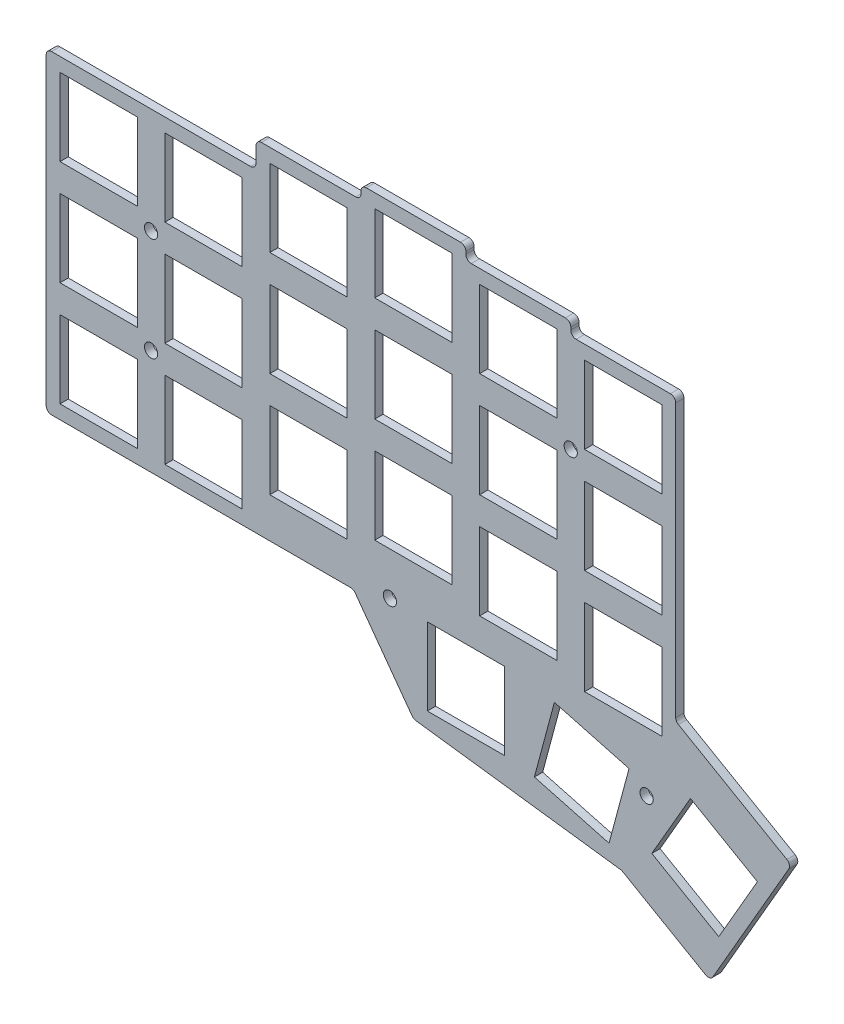
from build123d import *

# Parameters (mm, degrees)
SKETCH2_W           = 13.999999997
SKETCH2_H           = 13.999999996
SKETCH2_W_2         = 13.999999996
SKETCH2_R           = 1.2
SKETCH2_H_2         = 13.999999997
BOSS_EXTRUDE1_DEPTH = 1.5


with BuildPart() as part:
    # Sketch2 → Boss-Extrude1 (new body)
    with BuildSketch(Plane.XY):
        with BuildLine():
            ThreePointArc((3.358715952, 91.42556159), (2.678391323, 91.143761902), (2.396591635, 90.463437274))
            Line((2.396591635, 90.463437274), (2.396591635, 35.387693174))
            ThreePointArc((2.396591635, 35.387693174), (2.678391323, 34.707368546), (3.358715952, 34.425568858))
            Line((3.358715952, 34.425568858), (57.55538108, 34.425568858))
            ThreePointArc((57.55538108, 34.425568858), (57.991412266, 34.32109249), (58.332746845, 34.030353412))
            Line((58.332746845, 34.030353412), (68.6731028, 19.851286658))
            ThreePointArc((68.6731028, 19.851286658), (68.959916761, 19.590522811), (69.326358752, 19.464109602))
            Line((69.326358752, 19.464109602), (106.42211034, 14.638604201))
            ThreePointArc((106.42211034, 14.638604201), (106.606561986, 14.595821202), (106.779062685, 14.517742374))
            Line((106.779062685, 14.517742374), (121.831200494, 5.827386558))
            ThreePointArc((121.831200494, 5.827386558), (122.561278749, 5.731269932), (123.145486752, 6.1795485))
            Line((123.145486752, 6.1795485), (136.883362434, 29.974247168))
            ThreePointArc((136.883362434, 29.974247168), (136.979479059, 30.704325424), (136.531200492, 31.288533426))
            Line((136.531200492, 31.288533426), (116.881014221, 42.63357376))
            ThreePointArc((116.881014221, 42.63357376), (116.52885228, 42.985735701), (116.399952063, 43.466797859))
            Line((116.399952063, 43.466797859), (116.399952063, 92.828345033))
            ThreePointArc((116.399952063, 92.828345033), (116.118152375, 93.508669661), (115.437827746, 93.790469349))
            Line((115.437827746, 93.790469349), (98.360317754, 93.790469349))
            ThreePointArc((98.360317754, 93.790469349), (97.679993126, 94.072269037), (97.398193438, 94.752593666))
            Line((97.398193438, 94.752593666), (97.398193438, 95.213192117))
            ThreePointArc((97.398193438, 95.213192117), (97.11639375, 95.893516746), (96.436069121, 96.175316434))
            Line((96.436069121, 96.175316434), (79.359092742, 96.175316434))
            ThreePointArc((79.359092742, 96.175316434), (78.678768113, 96.457116122), (78.396968425, 97.137440751))
            Line((78.396968425, 97.137440751), (78.396968425, 97.587767164))
            ThreePointArc((78.396968425, 97.587767164), (78.115168737, 98.268091793), (77.434844109, 98.54989148))
            Line((77.434844109, 98.54989148), (60.359092745, 98.54989148))
            ThreePointArc((60.359092745, 98.54989148), (59.678768117, 98.268091793), (59.396968429, 97.587767164))
            Line((59.396968429, 97.587767164), (59.396968429, 97.133171852))
            ThreePointArc((59.396968429, 97.133171852), (59.115168741, 96.452847223), (58.434844112, 96.171047535))
            Line((58.434844112, 96.171047535), (41.357156249, 96.171047535))
            ThreePointArc((41.357156249, 96.171047535), (40.676831621, 95.889247847), (40.395031933, 95.208923218))
            Line((40.395031933, 95.208923218), (40.395031933, 92.387685907))
            ThreePointArc((40.395031933, 92.387685907), (40.113232245, 91.707361278), (39.432907616, 91.42556159))
            Line((39.432907616, 91.42556159), (3.358715952, 91.42556159))
        make_face()
        with Locations((11.896591633, 43.925568856)):
            Rectangle(SKETCH2_W, SKETCH2_H, mode=Mode.SUBTRACT)
        with Locations((30.894762974, 43.926240308)):
            Rectangle(SKETCH2_W_2, SKETCH2_H, mode=Mode.SUBTRACT)
        with Locations((64.637863533, 36.300090173)):
            Circle(SKETCH2_R, mode=Mode.SUBTRACT)
        with Locations((49.895031931, 48.671054801)):
            Rectangle(SKETCH2_W_2, SKETCH2_H_2, mode=Mode.SUBTRACT)
        with Locations((68.896968427, 51.049898746)):
            Rectangle(SKETCH2_W_2, SKETCH2_H, mode=Mode.SUBTRACT)
        Polygon((94.429437772, 34.880450616), (107.952399337, 31.256983985), (104.328932707, 17.734022421), (90.805971142, 21.357489051), align=None, mode=Mode.SUBTRACT)
        with Locations((111.137845658, 28.550051811)):
            Circle(SKETCH2_R, mode=Mode.SUBTRACT)
        Polygon((124.199361084, 13.004912388), (112.075005434, 20.004912386), (119.075005433, 32.129268036), (131.199361083, 25.129268038), align=None, mode=Mode.SUBTRACT)
        with Locations((78.416585941, 29.017413842)):
            Rectangle(SKETCH2_W_2, SKETCH2_H, mode=Mode.SUBTRACT)
        with Locations((87.89819344, 48.6753237)):
            Rectangle(SKETCH2_W, SKETCH2_H_2, mode=Mode.SUBTRACT)
        with Locations((106.899952065, 46.290476615)):
            Rectangle(SKETCH2_W, SKETCH2_H_2, mode=Mode.SUBTRACT)
        with Locations((11.896591633, 62.925568851)):
            Rectangle(SKETCH2_W, SKETCH2_H, mode=Mode.SUBTRACT)
        with Locations((21.387798276, 53.550235091)):
            Circle(SKETCH2_R, mode=Mode.SUBTRACT)
        with Locations((30.894762974, 62.926240303)):
            Rectangle(SKETCH2_W_2, SKETCH2_H, mode=Mode.SUBTRACT)
        with Locations((21.387798276, 72.300241098)):
            Circle(SKETCH2_R, mode=Mode.SUBTRACT)
        with Locations((49.895031931, 67.671054795)):
            Rectangle(SKETCH2_W_2, SKETCH2_H_2, mode=Mode.SUBTRACT)
        with Locations((68.896968427, 70.049898741)):
            Rectangle(SKETCH2_W_2, SKETCH2_H, mode=Mode.SUBTRACT)
        with Locations((11.896591633, 81.925561592)):
            Rectangle(SKETCH2_W, SKETCH2_H, mode=Mode.SUBTRACT)
        with Locations((30.894762974, 81.926233044)):
            Rectangle(SKETCH2_W_2, SKETCH2_H, mode=Mode.SUBTRACT)
        with Locations((49.895031931, 86.671047537)):
            Rectangle(SKETCH2_W_2, SKETCH2_H, mode=Mode.SUBTRACT)
        with Locations((68.896968427, 89.049891482)):
            Rectangle(SKETCH2_W_2, SKETCH2_H, mode=Mode.SUBTRACT)
        with Locations((87.89819344, 67.675323695)):
            Rectangle(SKETCH2_W, SKETCH2_H_2, mode=Mode.SUBTRACT)
        with Locations((106.899952065, 65.29047661)):
            Rectangle(SKETCH2_W, SKETCH2_H, mode=Mode.SUBTRACT)
        with Locations((97.387827206, 76.050038887)):
            Circle(SKETCH2_R, mode=Mode.SUBTRACT)
        with Locations((87.89819344, 86.675316436)):
            Rectangle(SKETCH2_W, SKETCH2_H_2, mode=Mode.SUBTRACT)
        with Locations((106.899952065, 84.290469351)):
            Rectangle(SKETCH2_W, SKETCH2_H, mode=Mode.SUBTRACT)
    extrude(amount=BOSS_EXTRUDE1_DEPTH)


solid = part.part
